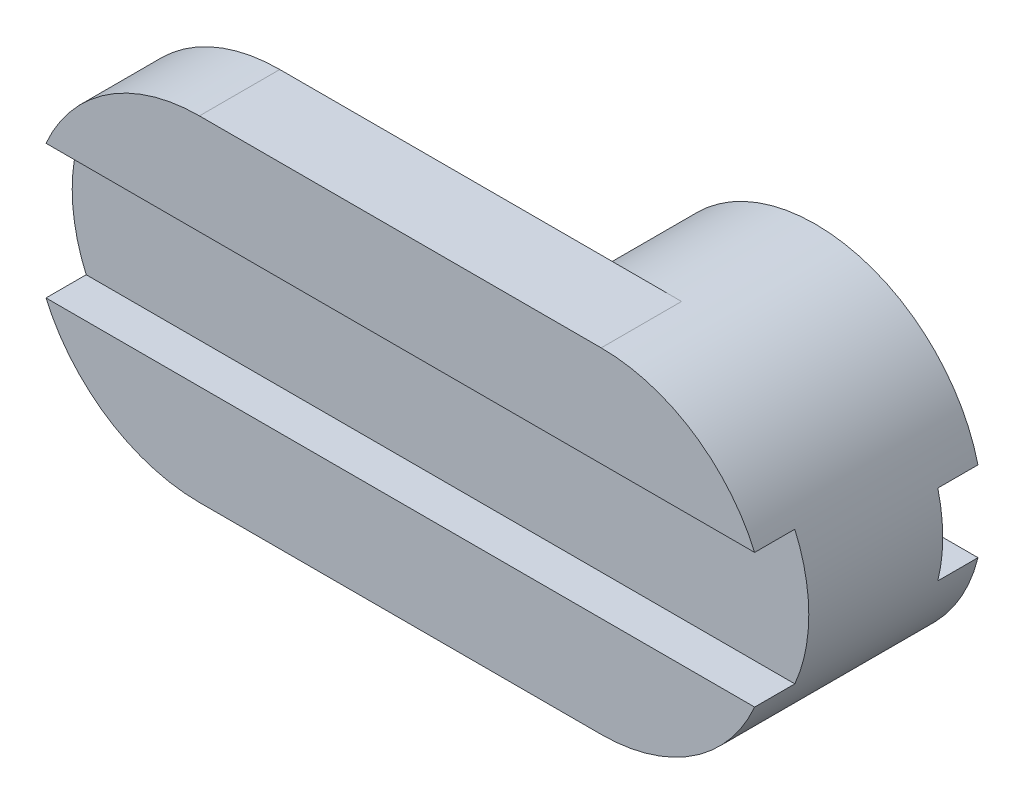
from build123d import *

# Parameters (mm, degrees)
BOSS_EXTRUDE1_DEPTH = 12
SKETCH2_W           = 115.368929346
SKETCH2_H           = 20
CUT_EXTRUDE1_DEPTH  = 6
BOSS_EXTRUDE2_START = 20
SKETCH3_R           = 25
SKETCH3_R_2         = 10
BOSS_EXTRUDE2_DEPTH = 20
SKETCH4_W           = 50
SKETCH4_H           = 12
CUT_EXTRUDE2_DEPTH  = 6
BOSS_EXTRUDE3_DEPTH = 4


with BuildPart() as part:
    # Sketch1 → Boss-Extrude1 (new body)
    with BuildSketch(Plane.XY):
        with BuildLine():
            Line((30, -25), (-30, -25))
            ThreePointArc((-30, -25), (-55, 0), (-30, 25))
            Line((-30, 25), (30, 25))
            ThreePointArc((30, 25), (55, 0), (30, -25))
        make_face()
    extrude(amount=BOSS_EXTRUDE1_DEPTH)

    # Sketch2 → Cut-Extrude1 (cut)
    with BuildSketch(Plane.XY.offset(12)):
        Rectangle(SKETCH2_W, SKETCH2_H)
    extrude(amount=-CUT_EXTRUDE1_DEPTH, mode=Mode.SUBTRACT)

    # Sketch3 → Boss-Extrude2 (add)
    with BuildSketch(Plane(origin=(0, 0, 0), x_dir=(-1, 0, 0), z_dir=(0, 0, -1)).offset(BOSS_EXTRUDE2_START)):
        with Locations((-30, 0)):
            Circle(SKETCH3_R)
        with Locations((-30, 0)):
            Circle(SKETCH3_R_2, mode=Mode.SUBTRACT)
    extrude(amount=-BOSS_EXTRUDE2_DEPTH)

    # Sketch4 → Cut-Extrude2 (cut)
    with BuildSketch(Plane(origin=(0, 0, -20), x_dir=(-1, 0, 0), z_dir=(0, 0, -1))):
        with Locations((-30, 0)):
            Rectangle(SKETCH4_W, SKETCH4_H)
    extrude(amount=-CUT_EXTRUDE2_DEPTH, mode=Mode.SUBTRACT)

    # Sketch5 → Boss-Extrude3 (add)
    with BuildSketch(Plane(origin=(0, 0, 0), x_dir=(-1, 0, 0), z_dir=(0, 0, -1))):
        with BuildLine():
            Line((18, 12), (30, 12))
            ThreePointArc((30, 12), (42, 0), (30, -12))
            Line((30, -12), (18, -12))
            ThreePointArc((18, -12), (6, 0), (18, 12))
        make_face()
        with BuildLine():
            Line((18, 6), (30, 6))
            ThreePointArc((30, 6), (36, 0), (30, -6))
            Line((30, -6), (18, -6))
            ThreePointArc((18, -6), (12, 0), (18, 6))
        make_face(mode=Mode.SUBTRACT)
    extrude(amount=BOSS_EXTRUDE3_DEPTH)


solid = part.part
